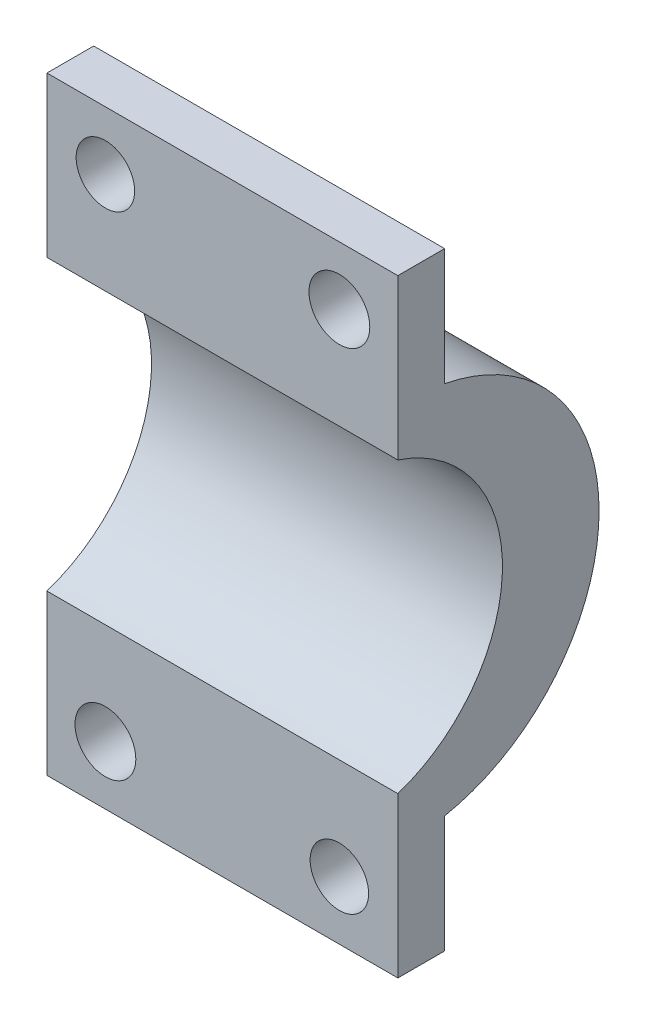
from build123d import *

# Parameters (mm, degrees)
SKETCH_1_W          = 30
SKETCH_1_H          = 32
EXTRUDE_1_DEPTH     = 7
EXTRUDE_2_DEPTH     = 30
SKETCH_3_W          = 30
SKETCH_3_H          = 10
SKETCH_3_R          = 2.6
SKETCH_3_R_2        = 2.5
EXTRUDE_3_DEPTH     = 4
CUT_EXTRUDE_1_DEPTH = 60


with BuildPart() as part:
    # Эскиз1 → Бобышка-Вытянуть1 (new body)
    with BuildSketch(Plane.XY):
        with Locations((15, 16)):
            Rectangle(SKETCH_1_W, SKETCH_1_H)
    extrude(amount=EXTRUDE_1_DEPTH)

    # Эскиз2 → Бобышка-Вытянуть2 (add)
    with BuildSketch(Plane.ZY):
        with BuildLine():
            Line((7, 32), (17.940751301, 32))
            Line((17.940751301, 32), (17.940751301, 28.35))
            ThreePointArc((17.940751301, 28.35), (9, 16), (17.940751301, 3.65))
            Line((17.940751301, 3.65), (17.940751301, 0))
            Line((17.940751301, 0), (7, 0))
            Line((7, 0), (7, 32))
        make_face()
    extrude(amount=-EXTRUDE_2_DEPTH)

    # Эскиз3 → Бобышка-Вытянуть3 (add)
    # profile 1 of 2: a face of its own
    with BuildSketch(Plane(origin=(0, 0, 17.940751301), x_dir=(-1, 0, 0), z_dir=(0, 0, -1))):
        with Locations((-15, 37)):
            Rectangle(SKETCH_3_W, SKETCH_3_H)
        with Locations(Location((-25, 37, 0), (0, 0, 180))):
            Circle(SKETCH_3_R, mode=Mode.SUBTRACT)
        with Locations(Location((-5, 37, 0), (0, 0, 180))):
            Circle(SKETCH_3_R_2, mode=Mode.SUBTRACT)
    # profile 2 of 2: a face of its own
    with BuildSketch(Plane(origin=(0, 0, 17.940751301), x_dir=(-1, 0, 0), z_dir=(0, 0, -1))):
        with Locations((-15, -5)):
            Rectangle(SKETCH_3_W, SKETCH_3_H)
        with Locations(Location((-25, -5, 0), (0, 0, 180))):
            Circle(SKETCH_3_R_2, mode=Mode.SUBTRACT)
        with Locations(Location((-5, -5, 0), (0, 0, 180))):
            Circle(SKETCH_3_R, mode=Mode.SUBTRACT)
    extrude(amount=EXTRUDE_3_DEPTH)

    # Эскиз4 → Вырез-Вытянуть1 (cut)
    with BuildSketch(Plane(origin=(30, 0, 0), x_dir=(0, 0, -1), z_dir=(1, 0, 0))):
        with BuildLine():
            Line((-13.940751301, 32), (0, 32))
            Line((0, 32), (0, 0))
            Line((0, 0), (-13.940751301, 0))
            ThreePointArc((-13.940751301, 0), (-0.73723231, 16), (-13.940751301, 32))
        make_face()
    extrude(amount=-CUT_EXTRUDE_1_DEPTH, mode=Mode.SUBTRACT)


solid = part.part
